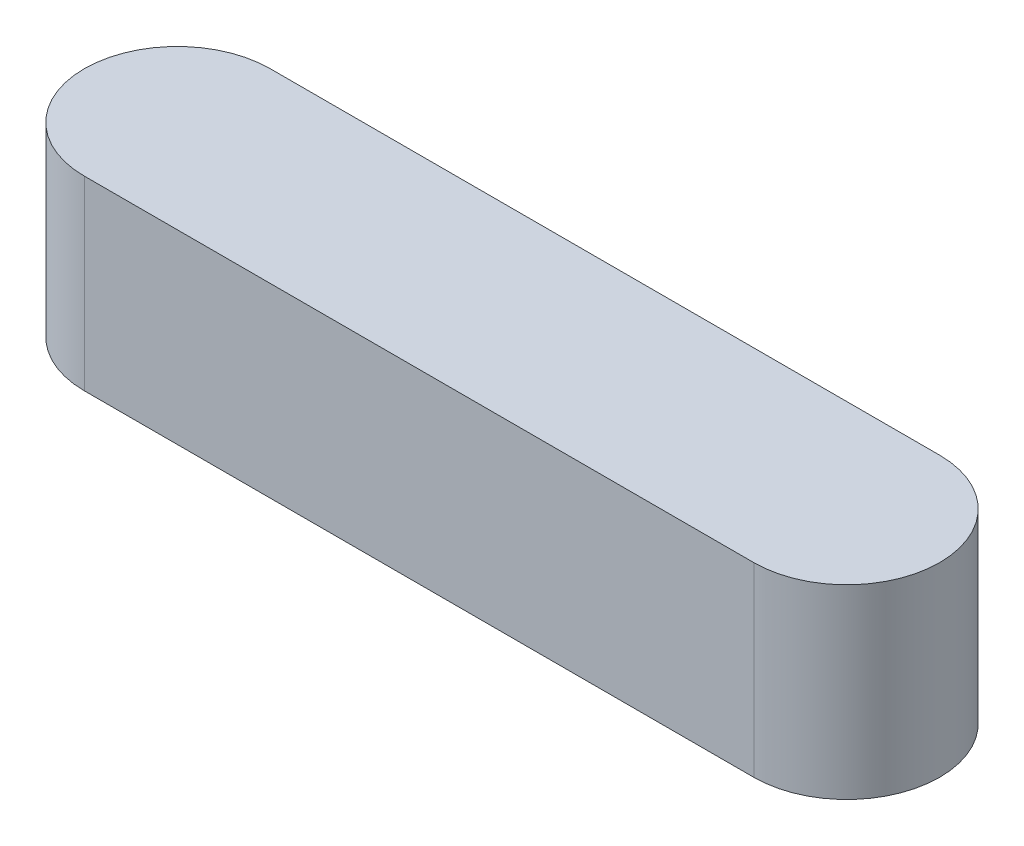
from build123d import *

# Parameters (mm, degrees)
EXTRUDE_1_DEPTH = 2.5


with BuildPart() as part:
    # ｽｹｯﾁ1 → ﾎﾞｽ - 押し出し1 (new, symmetric)
    with BuildSketch(Plane(origin=(0, 0, 0), x_dir=(1, 0, 0), z_dir=(0, 1, 0))):
        with BuildLine():
            Line((-9, 2.5), (9, 2.5))
            ThreePointArc((9, 2.5), (11.5, 0), (9, -2.5))
            Line((9, -2.5), (-9, -2.5))
            ThreePointArc((-9, -2.5), (-11.5, 0), (-9, 2.5))
        make_face()
    extrude(amount=EXTRUDE_1_DEPTH, both=True)


solid = part.part
